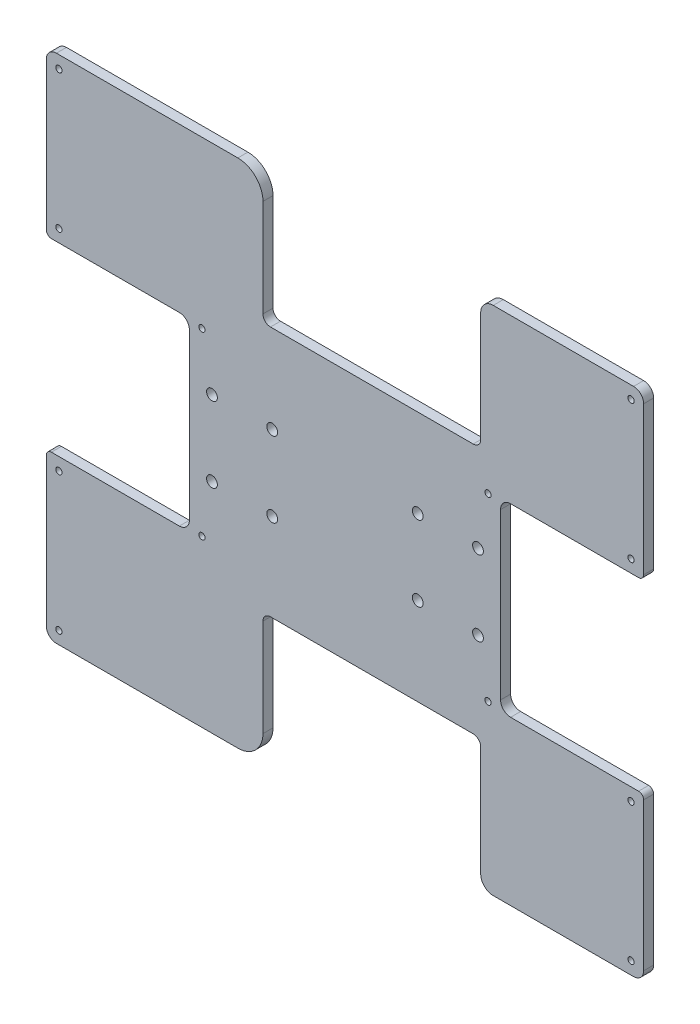
from build123d import *

# Parameters (mm, degrees)
SKETCH1_R                = 1.5
SKETCH1_R_2              = 1
BOSS_EXTRUDE1_DEPTH      = 4
M4_CLEARANCE_HOLE1_D     = 4.3
M4_CLEARANCE_HOLE1_DEPTH = 6
M4_CLEARANCE_HOLE1_TIP   = 1.291850331
M3_TAPPED_HOLE1_D        = 2.5
M3_TAPPED_HOLE1_DEPTH    = 7.5
M3_TAPPED_HOLE1_TIP      = 0.751075774


with BuildPart() as part:
    # Sketch1 → Boss-Extrude1 (new body)
    with BuildSketch(Plane.XY):
        with BuildLine():
            Line((-119, 97.846596312), (-119, 38.84934343))
            ThreePointArc((-119, 38.84934343), (-118.414213562, 37.435129868), (-117, 36.84934343))
            Line((-117, 36.84934343), (-65.999162166, 36.84934343))
            ThreePointArc((-65.999162166, 36.84934343), (-63.170735042, 35.677770555), (-61.999162166, 32.84934343))
            Line((-61.999162166, 32.84934343), (-61.999162166, -32.84934343))
            ThreePointArc((-61.999162166, -32.84934343), (-63.170735042, -35.677770555), (-65.999162166, -36.84934343))
            Line((-65.999162166, -36.84934343), (-117, -36.84934343))
            ThreePointArc((-117, -36.84934343), (-118.414213562, -37.435129868), (-119, -38.84934343))
            Line((-119, -38.84934343), (-119, -97.846596312))
            ThreePointArc((-119, -97.846596312), (-117.828427125, -100.675023437), (-115, -101.846596312))
            Line((-115, -101.846596312), (-42.690502092, -101.846596312))
            ThreePointArc((-42.690502092, -101.846596312), (-35.61943428, -98.917664124), (-32.690502092, -91.846596312))
            Line((-32.690502092, -91.846596312), (-32.690502092, -53.007425707))
            ThreePointArc((-32.690502092, -53.007425707), (-31.811822435, -50.886105364), (-29.690502092, -50.007425707))
            Line((-29.690502092, -50.007425707), (51.077147655, -50.007425707))
            ThreePointArc((51.077147655, -50.007425707), (53.198467999, -50.886105364), (54.077147655, -53.007425707))
            Line((54.077147655, -53.007425707), (54.077147655, -96.846596312))
            ThreePointArc((54.077147655, -96.846596312), (55.541613749, -100.382130218), (59.077147655, -101.846596312))
            Line((59.077147655, -101.846596312), (115, -101.846596312))
            ThreePointArc((115, -101.846596312), (117.828427125, -100.675023437), (119, -97.846596312))
            Line((119, -97.846596312), (119, -38.84934343))
            ThreePointArc((119, -38.84934343), (118.414213562, -37.435129868), (117, -36.84934343))
            Line((117, -36.84934343), (65.999162166, -36.84934343))
            ThreePointArc((65.999162166, -36.84934343), (63.170735042, -35.677770555), (61.999162166, -32.84934343))
            Line((61.999162166, -32.84934343), (61.999162166, 32.84934343))
            ThreePointArc((61.999162166, 32.84934343), (63.170735042, 35.677770555), (65.999162166, 36.84934343))
            Line((65.999162166, 36.84934343), (117, 36.84934343))
            ThreePointArc((117, 36.84934343), (118.414213562, 37.435129868), (119, 38.84934343))
            Line((119, 38.84934343), (119, 97.846596312))
            ThreePointArc((119, 97.846596312), (117.828427125, 100.675023437), (115, 101.846596312))
            Line((115, 101.846596312), (59.077147655, 101.846596312))
            ThreePointArc((59.077147655, 101.846596312), (55.541613749, 100.382130218), (54.077147655, 96.846596312))
            Line((54.077147655, 96.846596312), (54.077147655, 53.007425707))
            ThreePointArc((54.077147655, 53.007425707), (53.198467999, 50.886105364), (51.077147655, 50.007425707))
            Line((51.077147655, 50.007425707), (29.690502092, 50.007425707))
            Line((29.690502092, 50.007425707), (-29.690502092, 50.007425707))
            ThreePointArc((-29.690502092, 50.007425707), (-31.811822435, 50.886105364), (-32.690502092, 53.007425707))
            Line((-32.690502092, 53.007425707), (-32.690502092, 91.846596312))
            ThreePointArc((-32.690502092, 91.846596312), (-35.61943428, 98.917664124), (-42.690502092, 101.846596312))
            Line((-42.690502092, 101.846596312), (-115, 101.846596312))
            ThreePointArc((-115, 101.846596312), (-117.828427125, 100.675023437), (-119, 97.846596312))
        make_face()
        with Locations(Location((29, 15, 0), (0, 0, 180))):
            Circle(SKETCH1_R, mode=Mode.SUBTRACT)
        with Locations(Location((53, 15, 0), (0, 0, 180))):
            Circle(SKETCH1_R, mode=Mode.SUBTRACT)
        with Locations(Location((53, -15, 0), (0, 0, 180))):
            Circle(SKETCH1_R, mode=Mode.SUBTRACT)
        with Locations(Location((29, -15, 0), (0, 0, 180))):
            Circle(SKETCH1_R, mode=Mode.SUBTRACT)
        with Locations((-114, 41.84934343)):
            Circle(SKETCH1_R_2, mode=Mode.SUBTRACT)
        with Locations((-56.999162166, 35.84934343)):
            Circle(SKETCH1_R_2, mode=Mode.SUBTRACT)
        with Locations((-114, 96.846596312)):
            Circle(SKETCH1_R_2, mode=Mode.SUBTRACT)
        with Locations(Location((114, 96.846596312, 0), (0, 0, 180))):
            Circle(SKETCH1_R_2, mode=Mode.SUBTRACT)
        with Locations(Location((56.999162166, 35.84934343, 0), (0, 0, 180))):
            Circle(SKETCH1_R_2, mode=Mode.SUBTRACT)
        with Locations((-29, -15)):
            Circle(SKETCH1_R, mode=Mode.SUBTRACT)
        with Locations((-53, -15)):
            Circle(SKETCH1_R, mode=Mode.SUBTRACT)
        with Locations((-53, 15)):
            Circle(SKETCH1_R, mode=Mode.SUBTRACT)
        with Locations((-29, 15)):
            Circle(SKETCH1_R, mode=Mode.SUBTRACT)
        with Locations(Location((114, 41.84934343, 0), (0, 0, 180))):
            Circle(SKETCH1_R_2, mode=Mode.SUBTRACT)
        with Locations((114, -96.846596312)):
            Circle(SKETCH1_R_2, mode=Mode.SUBTRACT)
        with Locations((114, -41.84934343)):
            Circle(SKETCH1_R_2, mode=Mode.SUBTRACT)
        with Locations((56.999162166, -35.84934343)):
            Circle(SKETCH1_R_2, mode=Mode.SUBTRACT)
        with Locations(Location((-56.999162166, -35.84934343, 0), (0, 0, 180))):
            Circle(SKETCH1_R_2, mode=Mode.SUBTRACT)
        with Locations(Location((-114, -96.846596312, 0), (0, 0, 180))):
            Circle(SKETCH1_R_2, mode=Mode.SUBTRACT)
        with Locations(Location((-114, -41.84934343, 0), (0, 0, 180))):
            Circle(SKETCH1_R_2, mode=Mode.SUBTRACT)
    extrude(amount=BOSS_EXTRUDE1_DEPTH)

    # M4 Clearance Hole1
    with Locations(Plane(origin=(-53, 15, 4), x_dir=(1, 0, 0), z_dir=(0, 0, 1))):
        with Locations((0, 0), (24, 0), (0, -30), (24, -30), (82, -30), (106, -30), (106, 0), (82, 0)):
            Hole(M4_CLEARANCE_HOLE1_D / 2, depth=M4_CLEARANCE_HOLE1_DEPTH)
            with Locations((0, 0, -(M4_CLEARANCE_HOLE1_DEPTH + M4_CLEARANCE_HOLE1_TIP / 2))):  # 118° drill point
                Cone(0, M4_CLEARANCE_HOLE1_D / 2, M4_CLEARANCE_HOLE1_TIP, mode=Mode.SUBTRACT)

    # M3 Tapped Hole1
    with Locations(Plane(origin=(-114, -96.846596312, 4), x_dir=(1, 0, 0), z_dir=(0, 0, 1))):
        with Locations((0, 0), (228, 0), (228, 54.997252882), (170.999162166, 60.997252882), (57.000837834, 60.997252882), (0, 54.997252882), (0, 138.695939742), (57.000837834, 132.695939742), (0, 193.693192624), (170.999162166, 132.695939742), (228, 138.695939742), (228, 193.693192624)):
            Hole(M3_TAPPED_HOLE1_D / 2, depth=M3_TAPPED_HOLE1_DEPTH)
            with Locations((0, 0, -(M3_TAPPED_HOLE1_DEPTH + M3_TAPPED_HOLE1_TIP / 2))):  # 118° drill point
                Cone(0, M3_TAPPED_HOLE1_D / 2, M3_TAPPED_HOLE1_TIP, mode=Mode.SUBTRACT)


solid = part.part
